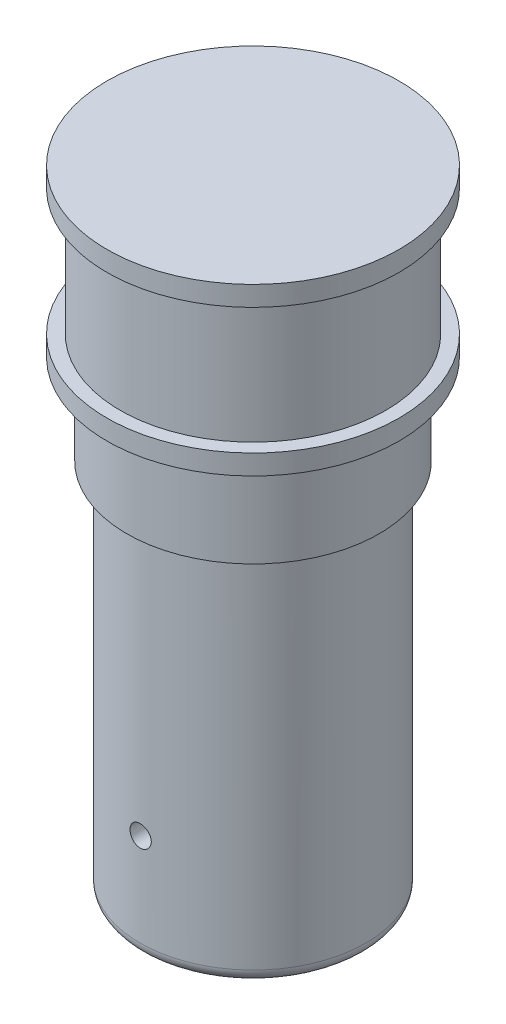
from build123d import *

# Parameters (mm, degrees)
FILLET1_R = 1
SKETCH3_W = 0.8
SKETCH3_H = 8.5


with BuildPart() as part:
    # Sketch1 → Revolve1 (revolve)
    with BuildSketch(Plane.XY):
        Polygon((-8.5, -35), (-8.5, -6.8), (-9.5, -6.8), (-9.5, 0), (-11, 0), (-11, 1.5), (-10, 1.5), (-10, 11), (-11, 11), (-11, 12.5), (0, 12.5), (0, -21), (-4, -21), (-4, -35), align=None)
    revolve(axis=Axis((0, 12.5, 0), (0, -1, 0)))

    # Fillet1
    fillet1_edges = [part.edges().sort_by_distance(p)[0] for p in [
        (8.5, -35, 0),
        (4, -35, 0),
    ]]
    fillet(fillet1_edges, radius=FILLET1_R)

    # Sketch3 → M2x0.4 Tapped Hole1 (revolve, cut)
    with BuildSketch(Plane(origin=(0, -27, 0), x_dir=(0, 1, 0), z_dir=(1, 0, 0))):
        with Locations((0.4, 4.25)):
            Rectangle(SKETCH3_W, SKETCH3_H)
    revolve(axis=Axis((0, -27, -6.35), (0, 0, 1)), mode=Mode.SUBTRACT)


solid = part.part
